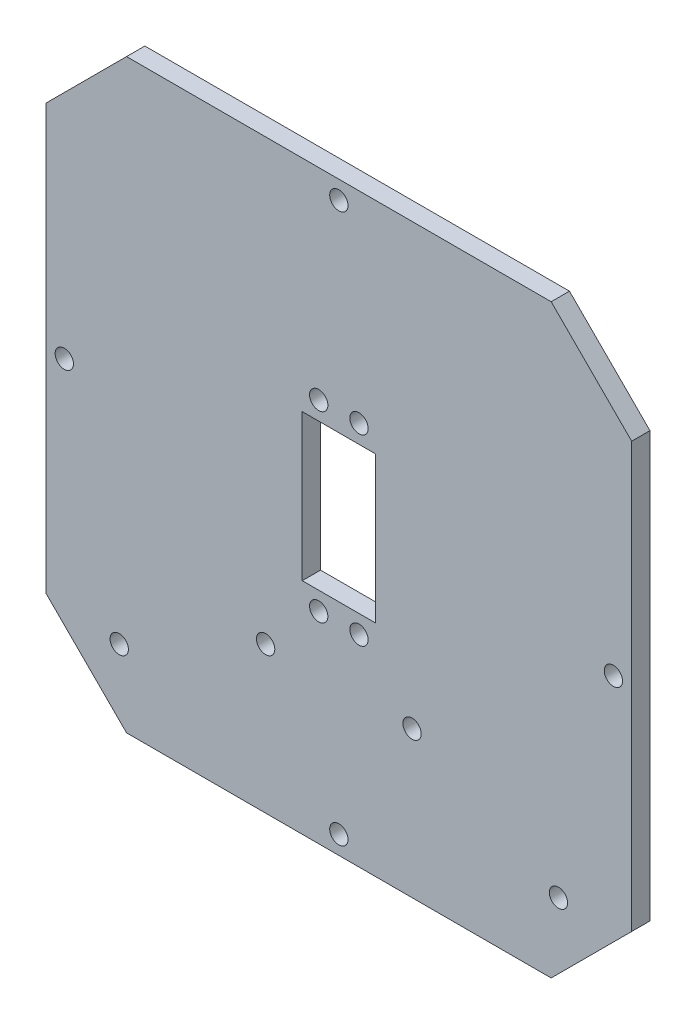
from build123d import *

# Parameters (mm, degrees)
ESQUISSE1_W             = 160
ESQUISSE1_H             = 160
BOSS_EXTRU_1_DEPTH      = 5
CHANFREIN1_SIZE         = 22
ESQUISSE2_W             = 20
ESQUISSE2_H             = 40
ENL_V_MAT_EXTRU_1_DEPTH = 5
ESQUISSE3_R             = 2.5
ENL_V_MAT_EXTRU_2_DEPTH = 5
ESQUISSE4_R             = 2.5
ENL_V_MAT_EXTRU_3_DEPTH = 5
ESQUISSE5_R             = 2.5
ENL_V_MAT_EXTRU_4_DEPTH = 10
ESQUISSE6_R             = 2.5
ENL_V_MAT_EXTRU_5_DEPTH = 10
ESQUISSE7_R             = 2.5
ENL_V_MAT_EXTRU_6_DEPTH = 10
ESQUISSE8_R             = 2.5
ENL_V_MAT_EXTRU_7_DEPTH = 10
ESQUISSE9_R             = 2.5
ENL_V_MAT_EXTRU_8_DEPTH = 30
ESQUISSE10_R            = 2.5
ENL_V_MAT_EXTRU_9_DEPTH = 30


with BuildPart() as part:
    # Esquisse1 → Boss.-Extru.1 (new body)
    with BuildSketch(Plane.XY):
        with Locations((51.649882403, -45.84323181)):
            Rectangle(ESQUISSE1_W, ESQUISSE1_H)
    extrude(amount=BOSS_EXTRU_1_DEPTH)

    # Chanfrein1
    chanfrein1_edges = [part.edges().sort_by_distance(p)[0] for p in [
        (-28.350117597, 34.15676819, 2.5),
        (131.649882403, 34.15676819, 2.5),
        (131.649882403, -125.84323181, 2.5),
        (-28.350117597, -125.84323181, 2.5),
    ]]
    chamfer(chanfrein1_edges, length=CHANFREIN1_SIZE)

    # Esquisse2 → Enlèv. mat.-Extru.1 (cut)
    with BuildSketch(Plane.XY.offset(5)):
        with Locations((51.649882403, -45.84323181)):
            Rectangle(ESQUISSE2_W, ESQUISSE2_H)
    extrude(amount=-ENL_V_MAT_EXTRU_1_DEPTH, mode=Mode.SUBTRACT)

    # Esquisse3 → Enlèv. mat.-Extru.2 (cut)
    with BuildSketch(Plane.XY.offset(5)):
        with Locations((46.149882403, -20.84323181)):
            Circle(ESQUISSE3_R)
        with Locations((57.149882403, -20.84323181)):
            Circle(ESQUISSE3_R)
    extrude(amount=-ENL_V_MAT_EXTRU_2_DEPTH, mode=Mode.SUBTRACT)

    # Esquisse4 → Enlèv. mat.-Extru.3 (cut)
    with BuildSketch(Plane.XY.offset(5)):
        with Locations((46.149882403, -70.84323181)):
            Circle(ESQUISSE4_R)
        with Locations((57.149882403, -61.84323181)):
            Circle(ESQUISSE4_R)
    extrude(amount=-ENL_V_MAT_EXTRU_3_DEPTH, mode=Mode.SUBTRACT)

    # Esquisse5 → Enlèv. mat.-Extru.4 (cut)
    with BuildSketch(Plane(origin=(0, 0, 0), x_dir=(-1, 0, 0), z_dir=(0, 0, -1))):
        with Locations((-57.149882403, -70.84323181)):
            Circle(ESQUISSE5_R)
    extrude(amount=-ENL_V_MAT_EXTRU_4_DEPTH, mode=Mode.SUBTRACT)

    # Esquisse6 → Enlèv. mat.-Extru.5 (cut)
    with BuildSketch(Plane.XY.offset(5)):
        with Locations((51.649882403, 29.15676819)):
            Circle(ESQUISSE6_R)
    extrude(amount=-ENL_V_MAT_EXTRU_5_DEPTH, mode=Mode.SUBTRACT)

    # Esquisse7 → Enlèv. mat.-Extru.6 (cut)
    with BuildSketch(Plane.XY.offset(5)):
        with Locations((-23.350117597, -45.84323181)):
            Circle(ESQUISSE7_R)
    extrude(amount=-ENL_V_MAT_EXTRU_6_DEPTH, mode=Mode.SUBTRACT)

    # Esquisse8 → Enlèv. mat.-Extru.7 (cut)
    with BuildSketch(Plane.XY.offset(5)):
        with Locations((51.649882403, -120.84323181)):
            Circle(ESQUISSE8_R)
        with Locations((126.649882403, -45.84323181)):
            Circle(ESQUISSE8_R)
    extrude(amount=-ENL_V_MAT_EXTRU_7_DEPTH, mode=Mode.SUBTRACT)

    # Esquisse9 → Enlèv. mat.-Extru.8 (cut)
    with BuildSketch(Plane.XY.offset(5)):
        with Locations((111.649882403, -105.84323181)):
            Circle(ESQUISSE9_R)
        with Locations((-8.350117597, -105.84323181)):
            Circle(ESQUISSE9_R)
    extrude(amount=-ENL_V_MAT_EXTRU_8_DEPTH, mode=Mode.SUBTRACT)

    # Esquisse10 → Enlèv. mat.-Extru.9 (cut)
    with BuildSketch(Plane(origin=(0, 0, 0), x_dir=(-1, 0, 0), z_dir=(0, 0, -1))):
        with Locations((-71.649882403, -85.84323181)):
            Circle(ESQUISSE10_R)
        with Locations((-31.649882403, -85.84323181)):
            Circle(ESQUISSE10_R)
    extrude(amount=-ENL_V_MAT_EXTRU_9_DEPTH, mode=Mode.SUBTRACT)


solid = part.part
